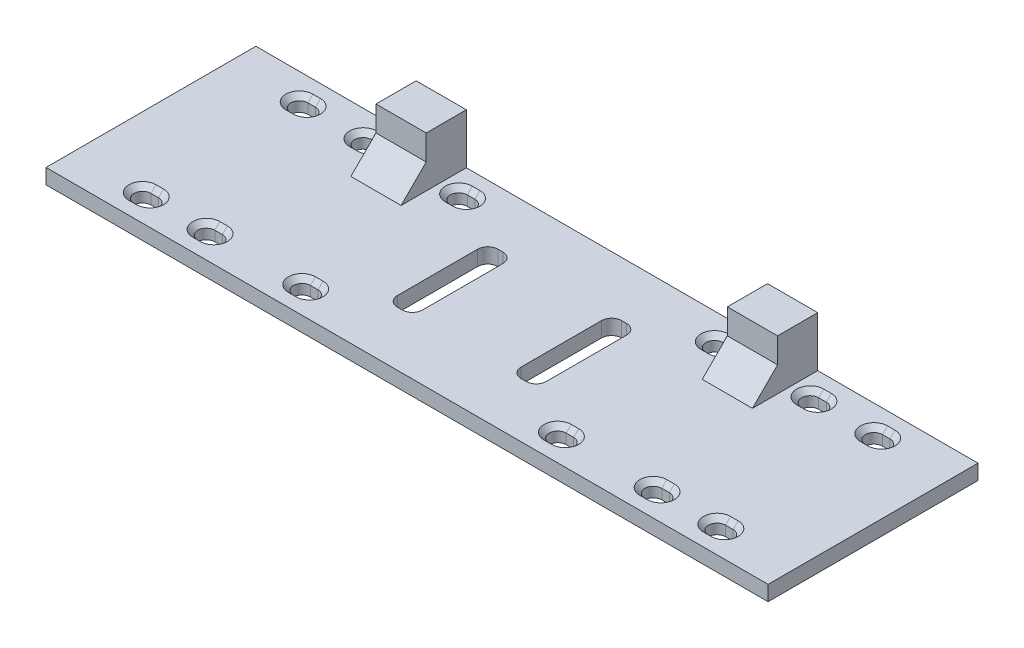
from build123d import *

# Parameters (mm, degrees)
SKETCH1_W           = 143.8
SKETCH1_H           = 41.8
SKETCH1_R           = 1.5875
BOSS_EXTRUDE1_DEPTH = 3
SKETCH4_W           = 10
SKETCH4_H           = 8
BOSS_EXTRUDE3_DEPTH = 10
CHAMFER2_SIZE       = 5
SKETCH5_R           = 2.2
CUT_EXTRUDE2_DEPTH  = 5.2
CUT_EXTRUDE3_DEPTH  = 10
CHAMFER3_SIZE       = 1
SKETCH8_W           = 5
SKETCH8_H           = 20
CUT_EXTRUDE4_DEPTH  = 10
FILLET1_R           = 2


with BuildPart() as part:
    # Sketch1 → Boss-Extrude1 (new body)
    with BuildSketch(Plane(origin=(0, 0, 0), x_dir=(1, 0, 0), z_dir=(0, 1, 0))):
        Rectangle(SKETCH1_W, SKETCH1_H)
        with Locations(Location((-57.2125, 15.621, 0), (0, 0, 270))):
            Circle(SKETCH1_R, mode=Mode.SUBTRACT)
        with Locations(Location((-44.5125, 15.621, 0), (0, 0, 270))):
            Circle(SKETCH1_R, mode=Mode.SUBTRACT)
        with Locations(Location((-25.4625, 15.621, 0), (0, 0, 270))):
            Circle(SKETCH1_R, mode=Mode.SUBTRACT)
        with Locations(Location((-25.4625, -15.621, 0), (0, 0, 270))):
            Circle(SKETCH1_R, mode=Mode.SUBTRACT)
        with Locations(Location((-44.5125, -15.621, 0), (0, 0, 270))):
            Circle(SKETCH1_R, mode=Mode.SUBTRACT)
        with Locations(Location((-57.2125, -15.621, 0), (0, 0, 270))):
            Circle(SKETCH1_R, mode=Mode.SUBTRACT)
        with Locations(Location((44.5125, -15.621, 0), (0, 0, 90))):
            Circle(SKETCH1_R, mode=Mode.SUBTRACT)
        with Locations(Location((25.4625, -15.621, 0), (0, 0, 90))):
            Circle(SKETCH1_R, mode=Mode.SUBTRACT)
        with Locations(Location((25.4625, 15.621, 0), (0, 0, 90))):
            Circle(SKETCH1_R, mode=Mode.SUBTRACT)
        with Locations(Location((44.5125, 15.621, 0), (0, 0, 90))):
            Circle(SKETCH1_R, mode=Mode.SUBTRACT)
        with Locations(Location((57.2125, 15.621, 0), (0, 0, 90))):
            Circle(SKETCH1_R, mode=Mode.SUBTRACT)
        with Locations(Location((57.2125, -15.621, 0), (0, 0, 90))):
            Circle(SKETCH1_R, mode=Mode.SUBTRACT)
    extrude(amount=BOSS_EXTRUDE1_DEPTH)

    # Sketch4 → Boss-Extrude3 (add)
    with BuildSketch(Plane(origin=(0, 3, 0), x_dir=(1, 0, 0), z_dir=(0, 1, 0))):
        with Locations((-34.9875, 16.9)):
            Rectangle(SKETCH4_W, SKETCH4_H)
        with Locations((34.9875, 16.9)):
            Rectangle(SKETCH4_W, SKETCH4_H)
    extrude(amount=BOSS_EXTRUDE3_DEPTH)

    # Chamfer2
    chamfer2_edges = [part.edges().sort_by_distance(p)[0] for p in [
        (-34.9875, 3, -12.9),
        (34.9875, 3, -12.9),
    ]]
    chamfer(chamfer2_edges, length=CHAMFER2_SIZE)

    # Sketch5 → Cut-Extrude2 (cut)
    with BuildSketch(Plane(origin=(0, 0, -20.9), x_dir=(-1, 0, 0), z_dir=(0, 0, -1))):
        with Locations((-34.9875, 6.5)):
            Circle(SKETCH5_R)
        with Locations((34.9875, 6.5)):
            Circle(SKETCH5_R)
    extrude(amount=-CUT_EXTRUDE2_DEPTH, mode=Mode.SUBTRACT)

    # Sketch7 → Cut-Extrude3 (cut)
    with BuildSketch(Plane(origin=(0, 3, 0), x_dir=(1, 0, 0), z_dir=(0, 1, 0))):
        with BuildLine():
            Line((-56.4625, 13.921), (-57.9625, 13.921))
            ThreePointArc((-57.9625, 13.921), (-59.6625, 15.621), (-57.9625, 17.321))
            Line((-57.9625, 17.321), (-56.4625, 17.321))
            ThreePointArc((-56.4625, 17.321), (-54.7625, 15.621), (-56.4625, 13.921))
        make_face()
        with BuildLine():
            Line((-43.7625, 13.921), (-45.2625, 13.921))
            ThreePointArc((-45.2625, 13.921), (-46.9625, 15.621), (-45.2625, 17.321))
            Line((-45.2625, 17.321), (-43.7625, 17.321))
            ThreePointArc((-43.7625, 17.321), (-42.0625, 15.621), (-43.7625, 13.921))
        make_face()
        with BuildLine():
            Line((-26.2125, 17.321), (-24.7125, 17.321))
            ThreePointArc((-24.7125, 17.321), (-23.0125, 15.621), (-24.7125, 13.921))
            Line((-24.7125, 13.921), (-26.2125, 13.921))
            ThreePointArc((-26.2125, 13.921), (-27.9125, 15.621), (-26.2125, 17.321))
        make_face()
        with BuildLine():
            Line((-43.7625, -17.321), (-45.2625, -17.321))
            ThreePointArc((-45.2625, -17.321), (-46.9625, -15.621), (-45.2625, -13.921))
            Line((-45.2625, -13.921), (-43.7625, -13.921))
            ThreePointArc((-43.7625, -13.921), (-42.0625, -15.621), (-43.7625, -17.321))
        make_face()
        with BuildLine():
            Line((-57.9625, -13.921), (-56.4625, -13.921))
            ThreePointArc((-56.4625, -13.921), (-54.7625, -15.621), (-56.4625, -17.321))
            Line((-56.4625, -17.321), (-57.9625, -17.321))
            ThreePointArc((-57.9625, -17.321), (-59.6625, -15.621), (-57.9625, -13.921))
        make_face()
        with BuildLine():
            Line((-24.7125, -17.321), (-26.2125, -17.321))
            ThreePointArc((-26.2125, -17.321), (-27.9125, -15.621), (-26.2125, -13.921))
            Line((-26.2125, -13.921), (-24.7125, -13.921))
            ThreePointArc((-24.7125, -13.921), (-23.0125, -15.621), (-24.7125, -17.321))
        make_face()
        with BuildLine():
            Line((56.4625, -13.921), (57.9625, -13.921))
            ThreePointArc((57.9625, -13.921), (59.6625, -15.621), (57.9625, -17.321))
            Line((57.9625, -17.321), (56.4625, -17.321))
            ThreePointArc((56.4625, -17.321), (54.7625, -15.621), (56.4625, -13.921))
        make_face()
        with BuildLine():
            Line((45.2625, -17.321), (43.7625, -17.321))
            ThreePointArc((43.7625, -17.321), (42.0625, -15.621), (43.7625, -13.921))
            Line((43.7625, -13.921), (45.2625, -13.921))
            ThreePointArc((45.2625, -13.921), (46.9625, -15.621), (45.2625, -17.321))
        make_face()
        with BuildLine():
            Line((24.7125, -13.921), (26.2125, -13.921))
            ThreePointArc((26.2125, -13.921), (27.9125, -15.621), (26.2125, -17.321))
            Line((26.2125, -17.321), (24.7125, -17.321))
            ThreePointArc((24.7125, -17.321), (23.0125, -15.621), (24.7125, -13.921))
        make_face()
        with BuildLine():
            Line((56.4625, 17.321), (57.9625, 17.321))
            ThreePointArc((57.9625, 17.321), (59.6625, 15.621), (57.9625, 13.921))
            Line((57.9625, 13.921), (56.4625, 13.921))
            ThreePointArc((56.4625, 13.921), (54.7625, 15.621), (56.4625, 17.321))
        make_face()
        with BuildLine():
            Line((43.7625, 17.321), (45.2625, 17.321))
            ThreePointArc((45.2625, 17.321), (46.9625, 15.621), (45.2625, 13.921))
            Line((45.2625, 13.921), (43.7625, 13.921))
            ThreePointArc((43.7625, 13.921), (42.0625, 15.621), (43.7625, 17.321))
        make_face()
        with BuildLine():
            Line((26.2125, 13.921), (24.7125, 13.921))
            ThreePointArc((24.7125, 13.921), (23.0125, 15.621), (24.7125, 17.321))
            Line((24.7125, 17.321), (26.2125, 17.321))
            ThreePointArc((26.2125, 17.321), (27.9125, 15.621), (26.2125, 13.921))
        make_face()
    extrude(amount=-CUT_EXTRUDE3_DEPTH, mode=Mode.SUBTRACT)

    # Chamfer3
    chamfer3_edges = [part.edges().sort_by_distance(p)[0] for p in [
        (-23.0125, 3, 15.621),
        (-25.4625, 3, 13.921),
        (-27.9125, 3, 15.621),
        (-25.4625, 3, 17.321),
        (54.7625, 3, 15.621),
        (57.2125, 3, 17.321),
        (59.6625, 3, 15.621),
        (57.2125, 3, 13.921),
        (46.9625, 3, 15.621),
        (44.5125, 3, 13.921),
        (42.0625, 3, 15.621),
        (44.5125, 3, 17.321),
        (23.0125, 3, 15.621),
        (25.4625, 3, 17.321),
        (27.9125, 3, 15.621),
        (25.4625, 3, 13.921),
        (-59.6625, 3, 15.621),
        (-57.2125, 3, 17.321),
        (-54.7625, 3, 15.621),
        (-57.2125, 3, 13.921),
        (-42.0625, 3, 15.621),
        (-44.5125, 3, 13.921),
        (-46.9625, 3, 15.621),
        (-44.5125, 3, 17.321),
        (-27.9125, 3, -15.621),
        (-25.4625, 3, -13.921),
        (-23.0125, 3, -15.621),
        (-25.4625, 3, -17.321),
        (-42.0625, 3, -15.621),
        (-44.5125, 3, -17.321),
        (-46.9625, 3, -15.621),
        (-44.5125, 3, -13.921),
        (54.7625, 3, -15.621),
        (57.2125, 3, -13.921),
        (59.6625, 3, -15.621),
        (57.2125, 3, -17.321),
        (42.0625, 3, -15.621),
        (44.5125, 3, -13.921),
        (46.9625, 3, -15.621),
        (44.5125, 3, -17.321),
        (27.9125, 3, -15.621),
        (25.4625, 3, -17.321),
        (23.0125, 3, -15.621),
        (25.4625, 3, -13.921),
        (-54.7625, 3, -15.621),
        (-57.2125, 3, -17.321),
        (-59.6625, 3, -15.621),
        (-57.2125, 3, -13.921),
    ]]
    chamfer(chamfer3_edges, length=CHAMFER3_SIZE)

    # Sketch8 → Cut-Extrude4 (cut)
    with BuildSketch(Plane(origin=(0, 3, 0), x_dir=(1, 0, 0), z_dir=(0, 1, 0))):
        with Locations((12.326083865, 0)):
            Rectangle(SKETCH8_W, SKETCH8_H)
        with Locations((-12.326083865, 0)):
            Rectangle(SKETCH8_W, SKETCH8_H)
    extrude(amount=-CUT_EXTRUDE4_DEPTH, mode=Mode.SUBTRACT)

    # Fillet1
    fillet1_edges = [part.edges().sort_by_distance(p)[0] for p in [
        (-9.826083865, 1.5, -10),
        (-9.826083865, 1.5, 10),
        (-14.826083865, 1.5, 10),
        (-14.826083865, 1.5, -10),
        (14.826083865, 1.5, -10),
        (14.826083865, 1.5, 10),
        (9.826083865, 1.5, 10),
        (9.826083865, 1.5, -10),
    ]]
    fillet(fillet1_edges, radius=FILLET1_R)


solid = part.part
